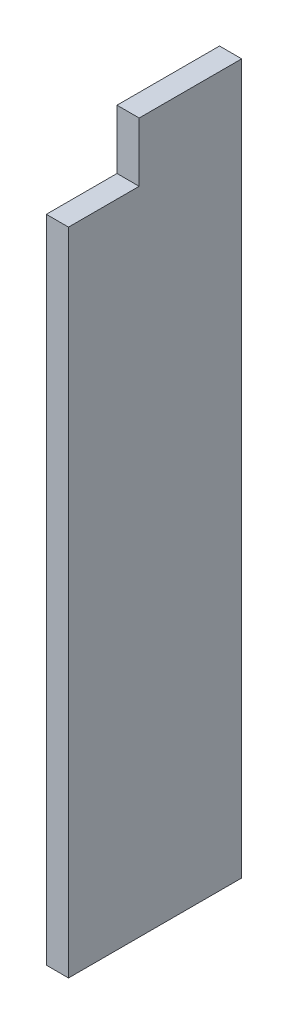
from build123d import *

# Parameters (mm, degrees)
SALIENTE_EXTRUIR1_DEPTH = 26


with BuildPart() as part:
    # Croquis1 → Saliente-Extruir1 (new body)
    with BuildSketch(Plane(origin=(0, 0, 0), x_dir=(0, 0, -1), z_dir=(1, 0, 0))):
        Polygon((32.979271971, 692.184964261), (32.979271971, 779.414233093), (-87.155446793, 779.414233093), (-87.155446793, 710.085632065), (-169.966048389, 710.085632065), (-169.966048389, -52.011115454), (32.979271971, -52.011115454), align=None)
    extrude(amount=SALIENTE_EXTRUIR1_DEPTH)


solid = part.part
